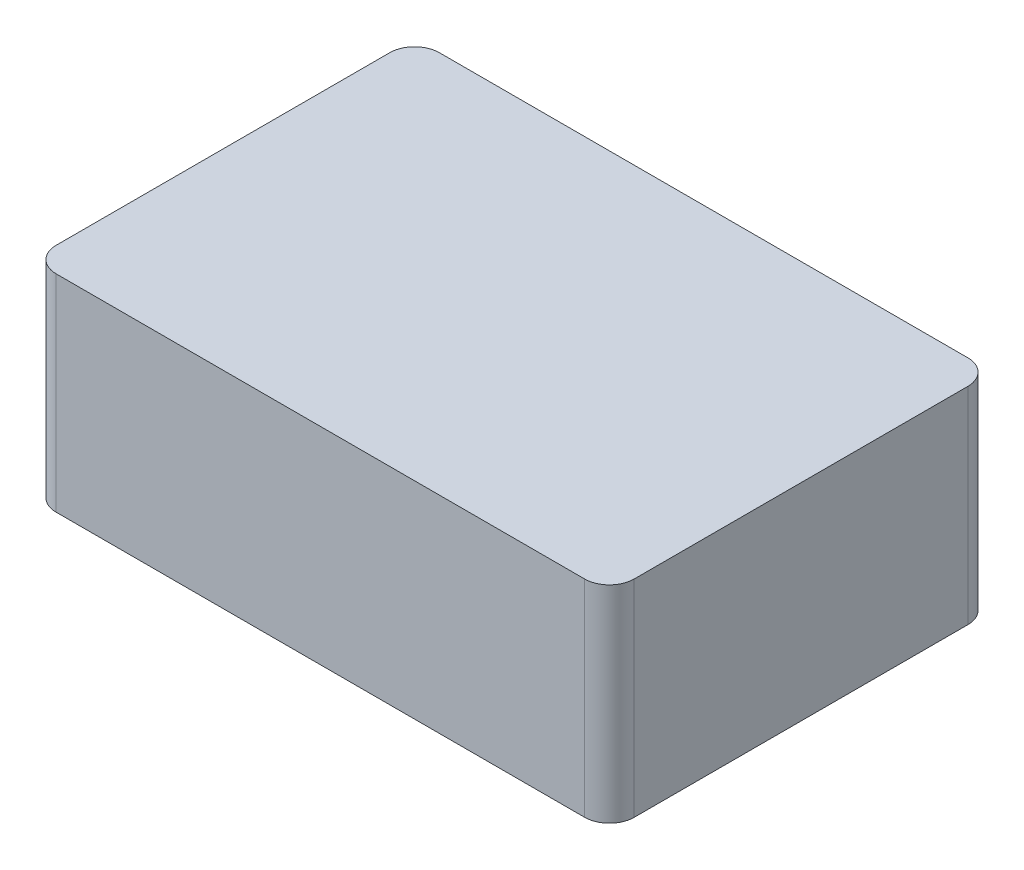
from build123d import *

# Parameters (mm, degrees)
SKETCH1_W           = 70
SKETCH1_H           = 46.4
BOSS_EXTRUDE1_DEPTH = 25
FILLET1_R           = 3


with BuildPart() as part:
    # Sketch1 → Boss-Extrude1 (new body)
    with BuildSketch(Plane(origin=(0, 0, 0), x_dir=(1, 0, 0), z_dir=(0, 1, 0))):
        Rectangle(SKETCH1_W, SKETCH1_H)
    extrude(amount=BOSS_EXTRUDE1_DEPTH)

    # Fillet1
    fillet1_edges = [part.edges().sort_by_distance(p)[0] for p in [
        (35, 12.5, 23.2),
        (-35, 12.5, 23.2),
        (-35, 12.5, -23.2),
        (35, 12.5, -23.2),
    ]]
    fillet(fillet1_edges, radius=FILLET1_R)


solid = part.part
